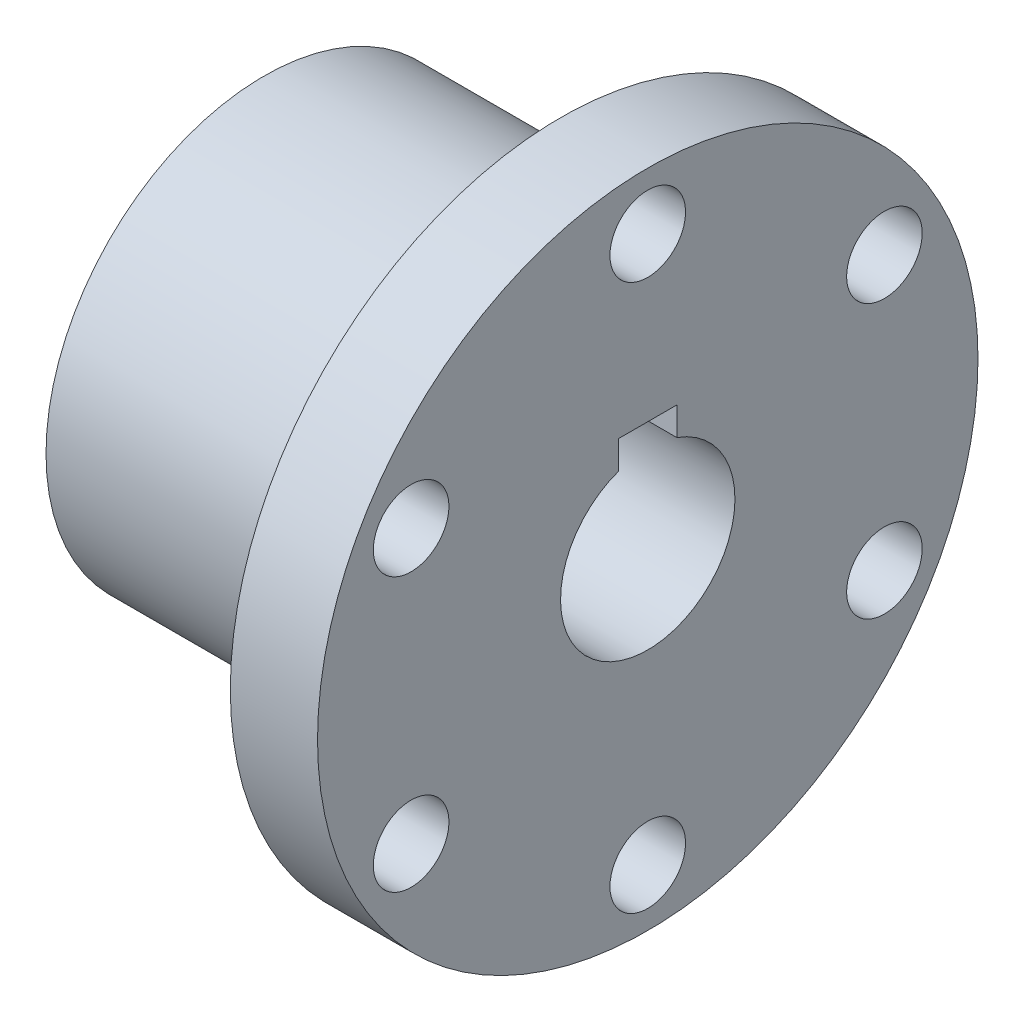
from build123d import *

# Parameters (mm, degrees)
HOLE_WIZARD_5_2_5_2_1_D           = 5.2
HOLE_WIZARD_5_2_5_2_1_CSINK_D     = 5.25
HOLE_WIZARD_5_2_5_2_1_CSINK_ANGLE = 90
SKETCH_4_W                        = 4
SKETCH_4_H                        = 4.736079205
CUT_EXTRUDE_1_DEPTH               = 35


with BuildPart() as part:
    # 草图1 → 旋转1 (revolve)
    with BuildSketch(Plane.XY, mode=Mode.PRIVATE) as revolve_1_sk:
        Polygon((0, 6), (0, 15), (20.4, 15), (20.4, 22.72), (26.4, 22.72), (26.4, 6), align=None)
    revolve(revolve_1_sk.sketch.rotate(Axis((0, 0, 0), (1, 0, 0)), 90), axis=Axis((0, 0, 0), (1, 0, 0)))

    # Ø5.2 (5.2) 直径孔1 (through all)
    with Locations(Plane.ZY.offset(-20.4)):
        with Locations((0, 18.8), (16.281277591, -9.4), (-16.281277591, -9.4), (0, -18.8), (-16.281277591, 9.4), (16.281277591, 9.4)):
            CounterSinkHole(HOLE_WIZARD_5_2_5_2_1_D / 2, HOLE_WIZARD_5_2_5_2_1_CSINK_D / 2, counter_sink_angle=HOLE_WIZARD_5_2_5_2_1_CSINK_ANGLE)

    # 草图4 → 切除-拉伸1 (cut)
    with BuildSketch(Plane.ZY):
        with Locations((0, 5.231960397)):
            Rectangle(SKETCH_4_W, SKETCH_4_H)
    extrude(amount=-CUT_EXTRUDE_1_DEPTH, mode=Mode.SUBTRACT)


solid = part.part
